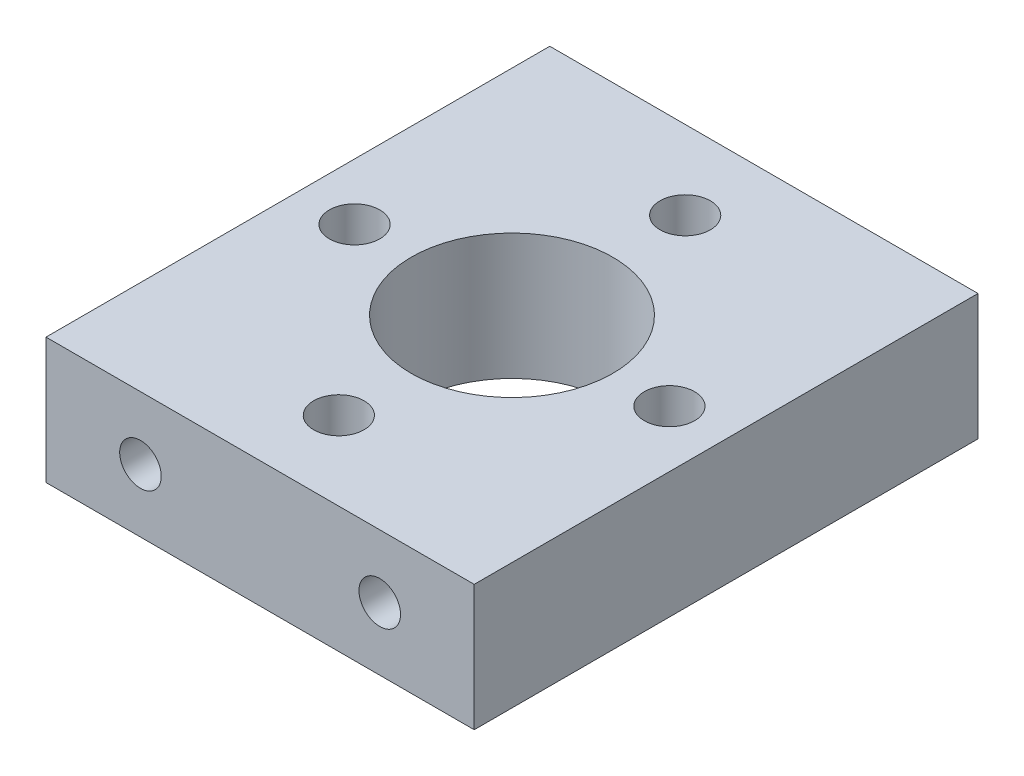
from build123d import *

# Parameters (mm, degrees)
SKETCH1_W                           = 34
SKETCH1_H                           = 40
SKETCH1_R                           = 8
SKETCH1_R_2                         = 2
BOSS_EXTRUDE1_DEPTH                 = 10
M4X0_7_TAPPED_HOLE1_D               = 3.3
M4X0_7_TAPPED_HOLE1_DEPTH           = 15
M4X0_7_TAPPED_HOLE1_TIP             = 0.991420021
M4X0_7_TAPPED_HOLE1_ON_FACE_2_D     = 3.3
M4X0_7_TAPPED_HOLE1_ON_FACE_2_DEPTH = 15
M4X0_7_TAPPED_HOLE1_ON_FACE_2_TIP   = 0.991420021


with BuildPart() as part:
    # Sketch1 → Boss-Extrude1 (new body)
    with BuildSketch(Plane(origin=(0, 0, 0), x_dir=(1, 0, 0), z_dir=(0, 1, 0))):
        Rectangle(SKETCH1_W, SKETCH1_H)
        with Locations(Location((0, 0, 0), (0, 0, 270))):
            Circle(SKETCH1_R, mode=Mode.SUBTRACT)
        with Locations(Location((0, 13.75, 0), (0, 0, 270))):
            Circle(SKETCH1_R_2, mode=Mode.SUBTRACT)
        with Locations(Location((0, -13.75, 0), (0, 0, 270))):
            Circle(SKETCH1_R_2, mode=Mode.SUBTRACT)
        with Locations(Location((-12.5, 0, 0), (0, 0, 270))):
            Circle(SKETCH1_R_2, mode=Mode.SUBTRACT)
        with Locations(Location((12.5, 0, 0), (0, 0, 270))):
            Circle(SKETCH1_R_2, mode=Mode.SUBTRACT)
    extrude(amount=BOSS_EXTRUDE1_DEPTH)

    # M4x0.7 Tapped Hole1
    with Locations(Plane(origin=(9.5, 5, -20), x_dir=(-1, 0, 0), z_dir=(0, 0, -1))):
        with Locations((0, 0), (19, 0)):
            Hole(M4X0_7_TAPPED_HOLE1_D / 2, depth=M4X0_7_TAPPED_HOLE1_DEPTH)
            with Locations((0, 0, -(M4X0_7_TAPPED_HOLE1_DEPTH + M4X0_7_TAPPED_HOLE1_TIP / 2))):  # 118° drill point
                Cone(0, M4X0_7_TAPPED_HOLE1_D / 2, M4X0_7_TAPPED_HOLE1_TIP, mode=Mode.SUBTRACT)

    # M4x0.7 Tapped Hole1 on face 2
    with Locations(Plane(origin=(-9.5, 5, 20), x_dir=(1, 0, 0), z_dir=(0, 0, 1))):
        with Locations((0, 0), (19, 0)):
            Hole(M4X0_7_TAPPED_HOLE1_ON_FACE_2_D / 2, depth=M4X0_7_TAPPED_HOLE1_ON_FACE_2_DEPTH)
            with Locations((0, 0, -(M4X0_7_TAPPED_HOLE1_ON_FACE_2_DEPTH + M4X0_7_TAPPED_HOLE1_ON_FACE_2_TIP / 2))):  # 118° drill point
                Cone(0, M4X0_7_TAPPED_HOLE1_ON_FACE_2_D / 2, M4X0_7_TAPPED_HOLE1_ON_FACE_2_TIP, mode=Mode.SUBTRACT)


solid = part.part
